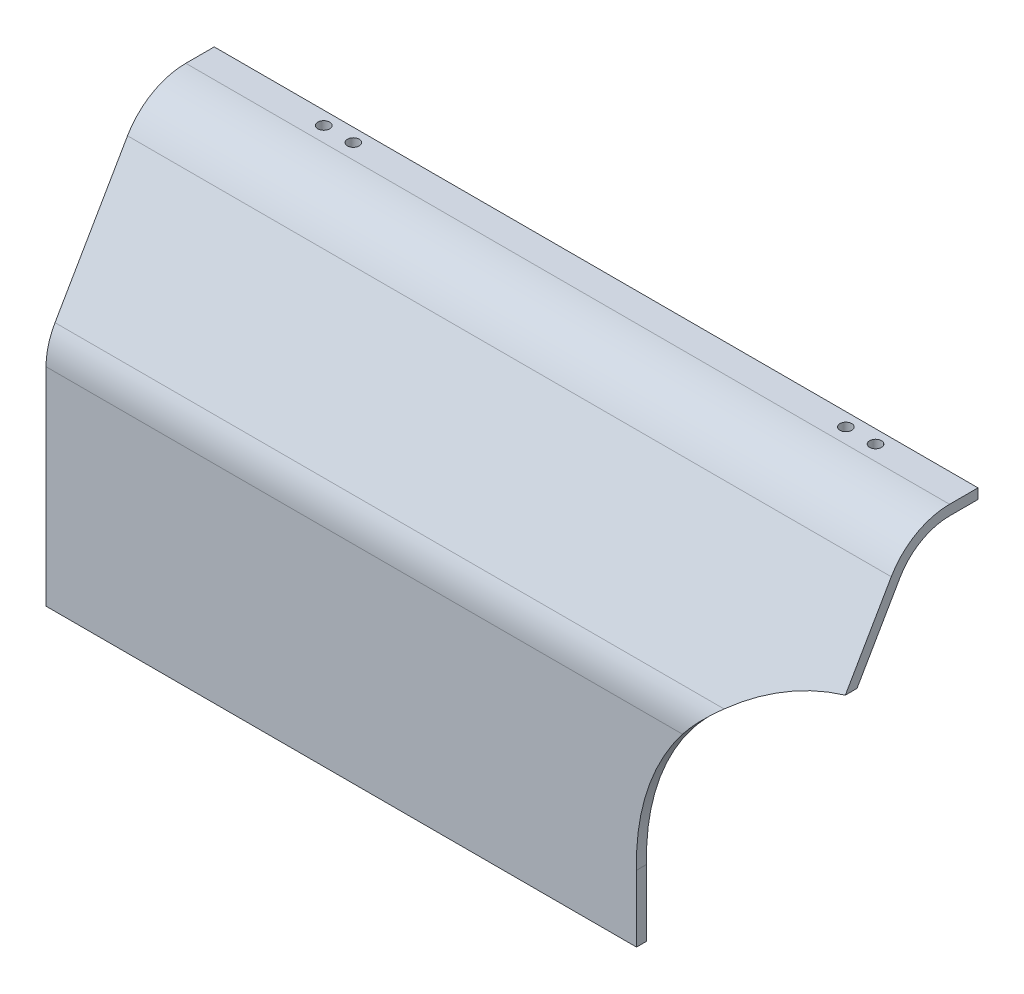
from build123d import *

# Parameters (mm, degrees)
SALIENTE_EXTRUIR1_DEPTH = 113.5
REDONDEO1_R             = 20
REDONDEO2_R             = 20
REDONDEO3_R             = 17
REDONDEO4_R             = 17
CROQUIS4_R              = 1.75
CORTAR_EXTRUIR3_DEPTH   = 4
CROQUIS5_R              = 1.75
CORTAR_EXTRUIR4_DEPTH   = 4
CROQUIS7_R              = 65
CORTAR_EXTRUIR6_DEPTH   = 172.854863901
CORTAR_EXTRUIR7_DEPTH   = 172.854863967


with BuildPart() as part:
    # Croquis1 → Saliente-Extruir1 (new, symmetric)
    with BuildSketch(Plane(origin=(0, 0, 0), x_dir=(0, 0, -1), z_dir=(1, 0, 0))):
        Polygon((0, 0), (0, 66.196152423), (28.732050808, 115.961524227), (47, 115.961524227), (47, 118.961524227), (27, 118.961524227), (-3, 67), (-3, 0), align=None)
    extrude(amount=SALIENTE_EXTRUIR1_DEPTH, both=True)

    # Redondeo1
    redondeo1_edges = [part.edges().sort_by_distance(p)[0] for p in [
        (0, 67, 3),
    ]]
    fillet(redondeo1_edges, radius=REDONDEO1_R)

    # Redondeo2
    redondeo2_edges = [part.edges().sort_by_distance(p)[0] for p in [
        (0, 118.961524227, -27),
    ]]
    fillet(redondeo2_edges, radius=REDONDEO2_R)

    # Redondeo3
    redondeo3_edges = [part.edges().sort_by_distance(p)[0] for p in [
        (0, 115.961524227, -28.732050808),
    ]]
    fillet(redondeo3_edges, radius=REDONDEO3_R)

    # Redondeo4
    redondeo4_edges = [part.edges().sort_by_distance(p)[0] for p in [
        (0, 66.196152423, 0),
    ]]
    fillet(redondeo4_edges, radius=REDONDEO4_R)

    # Croquis4 → Cortar-Extruir3 (cut)
    with BuildSketch(Plane(origin=(0, 118.961524227, 0), x_dir=(1, 0, 0), z_dir=(0, 1, 0))):
        with Locations(Location((-77, 43.047005384, 0), (0, 0, 270))):
            Circle(CROQUIS4_R)
        with Locations(Location((-68.2, 43.047005384, 0), (0, 0, 270))):
            Circle(CROQUIS4_R)
    extrude(amount=-CORTAR_EXTRUIR3_DEPTH, mode=Mode.SUBTRACT)

    # Croquis5 → Cortar-Extruir4 (cut)
    with BuildSketch(Plane(origin=(0, 118.961524227, 0), x_dir=(1, 0, 0), z_dir=(0, 1, 0))):
        with Locations(Location((78.2, 43.047005384, 0), (0, 0, 270))):
            Circle(CROQUIS5_R)
        with Locations(Location((87, 43.047005384, 0), (0, 0, 270))):
            Circle(CROQUIS5_R)
    extrude(amount=-CORTAR_EXTRUIR4_DEPTH, mode=Mode.SUBTRACT)

    # Croquis7 → Cortar-Extruir6 (cut, through all)
    with BuildSketch(Plane.XY.offset(3)):
        with Locations((126.978079309, 21.721524227)):
            Circle(CROQUIS7_R)
    extrude(amount=-CORTAR_EXTRUIR6_DEPTH, mode=Mode.SUBTRACT)

    # Croquis8 → Cortar-Extruir7 (cut, through all)
    with BuildSketch(Plane.XY.offset(3)):
        with BuildLine():
            Line((65.714914314, 0), (62.007039343, 0))
            Line((62.007039343, 0), (62.007039343, 19.781429967))
            ThreePointArc((62.007039343, 19.781429967), (63.090718522, 9.746336063), (65.714914314, 0))
        make_face()
    extrude(amount=-CORTAR_EXTRUIR7_DEPTH, mode=Mode.SUBTRACT)


solid = part.part
